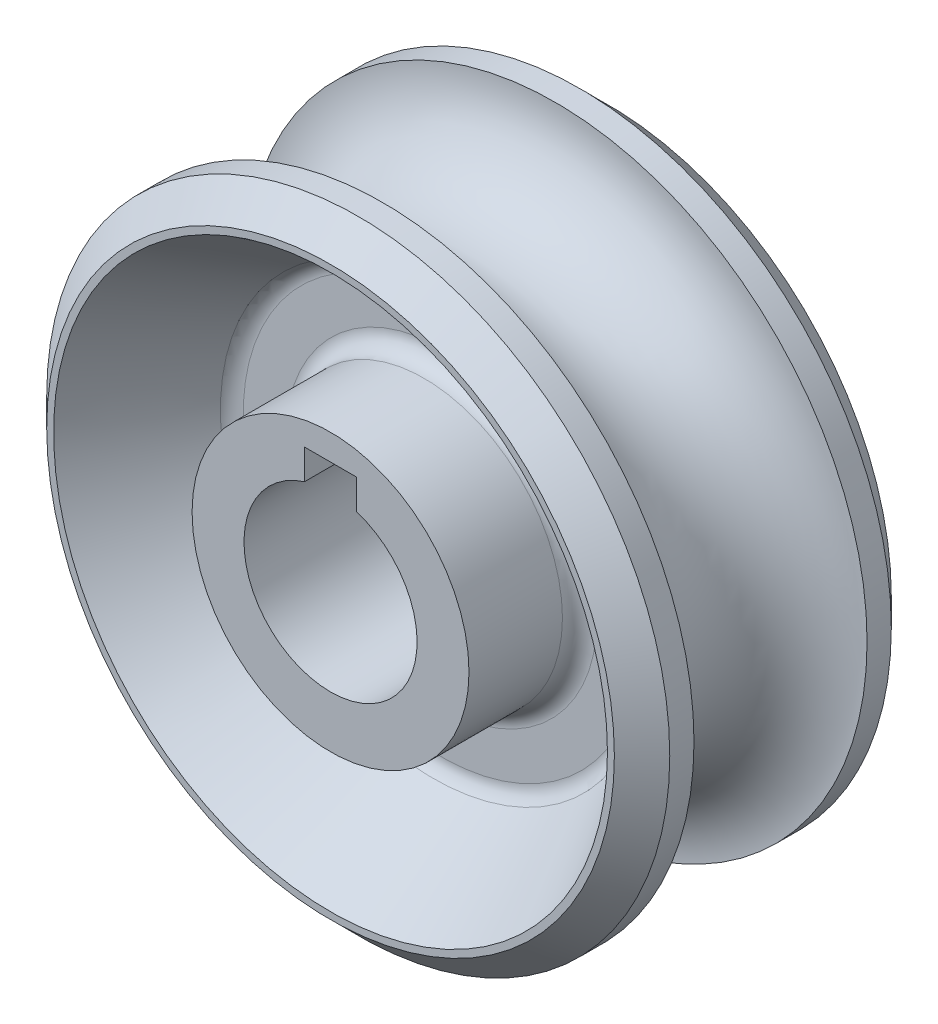
from build123d import *

# Parameters (mm, degrees)
SKETCH2_R               = 28.575
SKETCH2_R_2             = 7.9375
BOSS_EXTRUDE1_DEPTH     = 12.7
SKETCH3_R               = 7.9375
CHAMFER1_SIZE           = 2.54
FILLET1_R               = 1.5875
CUT_EXTRUDE1_DEPTH      = 43.359783404
CUT_EXTRUDE1_DEPTH_BACK = 43.359783404
SKETCH5_W               = 4.7752
SKETCH5_H               = 10.3251


with BuildPart() as part:
    # Sketch2 → Boss-Extrude1 (new, symmetric)
    with BuildSketch(Plane.XY):
        Circle(SKETCH2_R)
        Circle(SKETCH2_R_2, mode=Mode.SUBTRACT)
    extrude(amount=BOSS_EXTRUDE1_DEPTH, both=True)

    # Sketch3 → Cut-Revolve1 (revolve, cut)
    with BuildSketch(Plane(origin=(0, 0, 0), x_dir=(0, 0, -1), z_dir=(1, 0, 0)), mode=Mode.PRIVATE) as cut_revolve1_sk:
        with Locations((0, 28.575)):
            Circle(SKETCH3_R)
    revolve(cut_revolve1_sk.sketch.rotate(Axis((0, 0, 0), (0, 0, -1)), 90), axis=Axis((0, 0, 0), (0, 0, -1)), mode=Mode.SUBTRACT)

    # Sketch4 → Cut-Revolve2 (revolve, cut)
    with BuildSketch(Plane(origin=(0, 0, 0), x_dir=(0, 0, -1), z_dir=(1, 0, 0)), mode=Mode.PRIVATE) as cut_revolve2_sk:
        Polygon((12.7, 25.4), (2.54, 19.05), (2.54, 12.7), (12.7, 12.7), align=None)
        Polygon((-12.7, 12.7), (-12.7, 25.4), (-2.54, 19.05), (-2.54, 12.7), align=None)
    revolve(cut_revolve2_sk.sketch.rotate(Axis((0, 0, 0), (0, 0, -1)), 90), axis=Axis((0, 0, 0), (0, 0, -1)), mode=Mode.SUBTRACT)

    # Chamfer1
    chamfer1_edges = [part.edges().sort_by_distance(p)[0] for p in [
        (-28.575, 0, -12.7),
        (-28.575, 0, 12.7),
    ]]
    chamfer(chamfer1_edges, length=CHAMFER1_SIZE)

    # Fillet1
    fillet1_edges = [part.edges().sort_by_distance(p)[0] for p in [
        (-12.7, 0, -2.54),
        (-19.05, 0, -2.54),
        (-19.05, 0, 2.54),
        (-12.7, 0, 2.54),
    ]]
    fillet(fillet1_edges, radius=FILLET1_R)

    # Sketch5 → Cut-Extrude1 (cut, two sides: drawn at the far end of the back side and taken through both)
    with BuildSketch(Plane.XY.offset(-CUT_EXTRUDE1_DEPTH_BACK)):
        with Locations((0, 5.16255)):
            Rectangle(SKETCH5_W, SKETCH5_H)
    extrude(amount=CUT_EXTRUDE1_DEPTH + CUT_EXTRUDE1_DEPTH_BACK, mode=Mode.SUBTRACT)


solid = part.part
